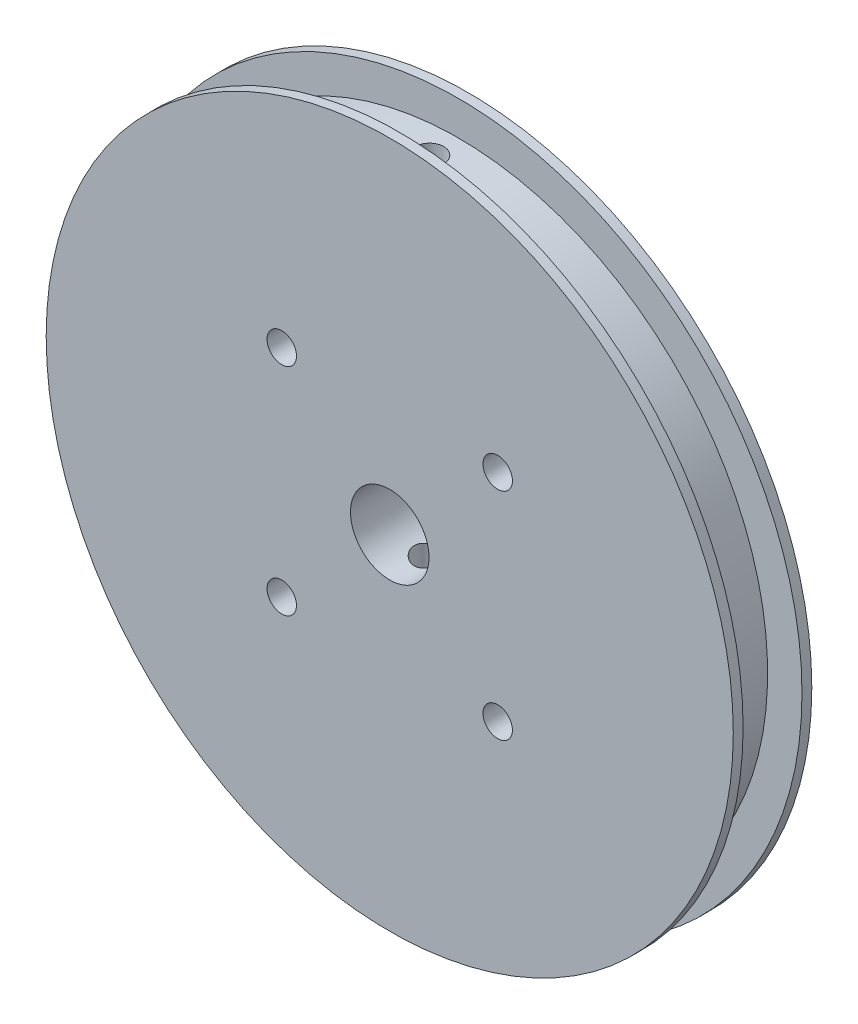
from build123d import *

# Parameters (mm, degrees)
SKETCH1_R                                       = 35
PULLEY_BOSS_EXTRUDE1_DEPTH                      = 8
SKETCH2_W                                       = 3.5
SKETCH2_H                                       = 6
SKETCH3_R                                       = 4
SHAFT_CUT_EXTRUDE1_DEPTH                        = 8
SPRINT_HOLE_CUT_EXTRUDE2_REACH                  = 52.14
SPRINT_HOLE_CUT_EXTRUDE2_END_RADIUS             = 31.5
SKETCH4_R                                       = 1.5
SPRINT_HOLE_CUT_EXTRUDE2_DIRECTION_2_REACH      = 52.14
SPRINT_HOLE_CUT_EXTRUDE2_DIRECTION_2_END_RADIUS = 31.5
SKETCH5_R                                       = 1.5
ARM_DISTANS_MOUNTING_HOLES_CUT_EXTRUDE1_DEPTH   = 8


with BuildPart() as part:
    # Sketch1 → Pulley Boss-Extrude1 (new body)
    with BuildSketch(Plane.XY):
        Circle(SKETCH1_R)
    extrude(amount=PULLEY_BOSS_EXTRUDE1_DEPTH)

    # Sketch2 → Belt Cut-Revolve3 (revolve, cut)
    with BuildSketch(Plane(origin=(0, 0, 0), x_dir=(1, 0, 0), z_dir=(0, 1, 0)), mode=Mode.PRIVATE) as belt_cut_revolve3_sk:
        with Locations((33.25, -4)):
            Rectangle(SKETCH2_W, SKETCH2_H)
    revolve(belt_cut_revolve3_sk.sketch.rotate(Axis((0, 0, -14.62158436), (0, 0, 1)), 180), axis=Axis((0, 0, -14.62158436), (0, 0, 1)), mode=Mode.SUBTRACT)

    # Sketch3 → Shaft Cut-Extrude1 (cut)
    with BuildSketch(Plane.XY):
        with Locations(Location((0, 0, 0), (0, 0, 180))):
            Circle(SKETCH3_R)
    extrude(amount=SHAFT_CUT_EXTRUDE1_DEPTH, mode=Mode.SUBTRACT)

    # Sprint Hole Cut-Extrude2: up to this cylinder (the profile starts inside it)
    sprint_hole_cut_extrude2_end = Plane(origin=(0, 0, 4), z_dir=(0, 0, -1)) * Cylinder(SPRINT_HOLE_CUT_EXTRUDE2_END_RADIUS, 168.28, mode=Mode.PRIVATE)
    # Sketch4 → Sprint Hole Cut-Extrude2 (cut, up to the surface)
    with BuildSketch(Plane(origin=(0, 0, 0), x_dir=(1, 0, 0), z_dir=(0, 1, 0)), mode=Mode.PRIVATE) as sprint_hole_cut_extrude2_sk1:
        with Locations(Location((0, -4, 0), (0, 0, 270))):
            Circle(SKETCH4_R)
    sprint_hole_cut_extrude2_tool1 = extrude(sprint_hole_cut_extrude2_sk1.sketch, amount=-SPRINT_HOLE_CUT_EXTRUDE2_REACH, mode=Mode.PRIVATE) & sprint_hole_cut_extrude2_end
    add(sprint_hole_cut_extrude2_tool1.solids().sort_by_distance((0, 0, 4))[0], mode=Mode.SUBTRACT)

    # Sprint Hole Cut-Extrude2 direction 2: up to this cylinder (the profile starts inside it)
    sprint_hole_cut_extrude2_direction_2_end = Plane(origin=(0, 0, 4), z_dir=(0, 0, -1)) * Cylinder(SPRINT_HOLE_CUT_EXTRUDE2_DIRECTION_2_END_RADIUS, 168.28, mode=Mode.PRIVATE)
    # Sketch4 → Sprint Hole Cut-Extrude2 direction 2 (cut, up to the surface)
    with BuildSketch(Plane(origin=(0, 0, 0), x_dir=(1, 0, 0), z_dir=(0, 1, 0)), mode=Mode.PRIVATE) as sprint_hole_cut_extrude2_direction_2_sk1:
        with Locations(Location((0, -4, 0), (0, 0, 270))):
            Circle(SKETCH4_R)
    sprint_hole_cut_extrude2_direction_2_tool1 = extrude(sprint_hole_cut_extrude2_direction_2_sk1.sketch, amount=SPRINT_HOLE_CUT_EXTRUDE2_DIRECTION_2_REACH, mode=Mode.PRIVATE) & sprint_hole_cut_extrude2_direction_2_end
    add(sprint_hole_cut_extrude2_direction_2_tool1.solids().sort_by_distance((0, 0, 4))[0], mode=Mode.SUBTRACT)

    # Sketch5 → Arm Distans Mounting Holes Cut-Extrude1 (cut)
    with BuildSketch(Plane.XY.offset(8)):
        with Locations((11, 11)):
            Circle(SKETCH5_R)
        with Locations((-11, 11)):
            Circle(SKETCH5_R)
        with Locations((-11, -11)):
            Circle(SKETCH5_R)
        with Locations((11, -11)):
            Circle(SKETCH5_R)
    extrude(amount=-ARM_DISTANS_MOUNTING_HOLES_CUT_EXTRUDE1_DEPTH, mode=Mode.SUBTRACT)


solid = part.part
